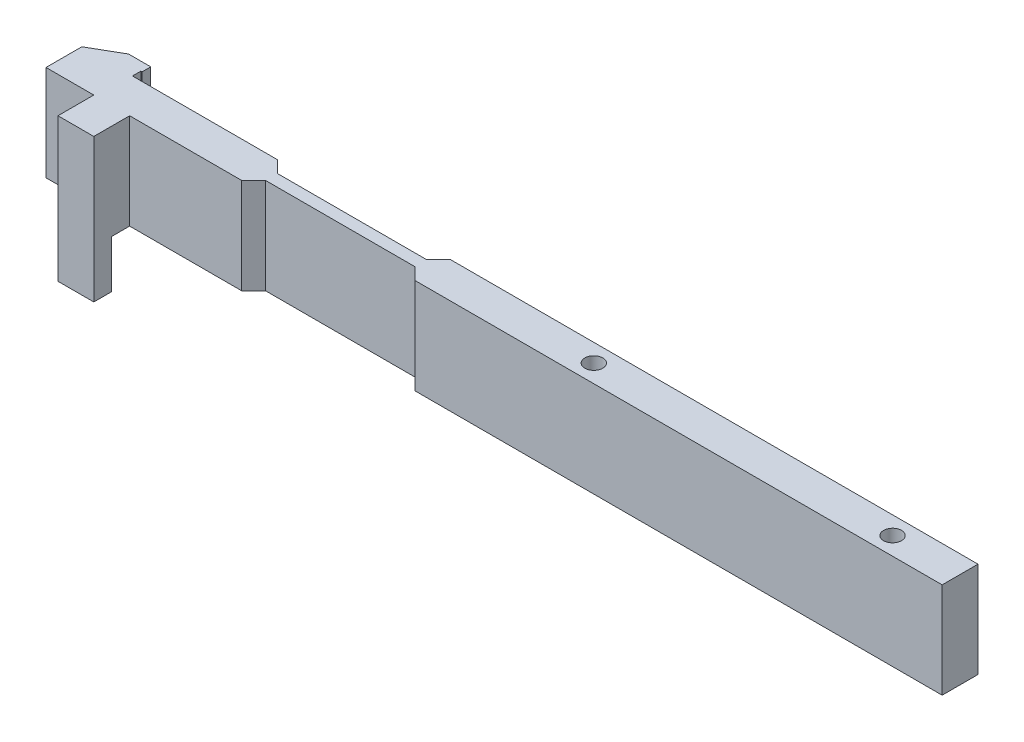
from build123d import *

# Parameters (mm, degrees)
EXTRUDE_1_DEPTH     = 16
SKETCH_3_R          = 1.5
CUT_EXTRUDE_1_DEPTH = 82.804645345
SKETCH_4_W          = 6
SKETCH_4_H          = 6
EXTRUDE_2_DEPTH     = 16
EXTRUDE_START       = -16
EXTRUDE_4_DEPTH     = 8


with BuildPart() as part:
    # Эскиз1 → Бобышка-Вытянуть1 (new body)
    with BuildSketch(Plane(origin=(0, 0, 0), x_dir=(1, 0, 0), z_dir=(0, 1, 0))):
        Polygon((0, 0), (-71.525936721, 0), (-71.525936721, 1.396480231), (-71.325936721, 1.396480231), (-71.325936721, 2.8586364), (-75.035652424, 2.8586364), (-80, -0.007531009), (-80, -6), (70, -6), (70, 0), align=None)
    extrude(amount=EXTRUDE_1_DEPTH)

    # Эскиз3 → Вырез-Вытянуть1 (cut, through all)
    with BuildSketch(Plane(origin=(0, 16, 0), x_dir=(1, 0, 0), z_dir=(0, 1, 0))):
        with Locations(Location((8.699103215, -3.003765504, 0), (0, 0, 270))):
            Circle(SKETCH_3_R)
        with Locations(Location((58.699103215, -3.003765504, 0), (0, 0, 270))):
            Circle(SKETCH_3_R)
        Polygon((-47.243192472, 0), (-45.239426968, -2.003765504), (-20.270391363, -2.003765504), (-18.266625858, 0), align=None)
        Polygon((-47.243192472, -6.007531009), (-18.266625858, -6.007531009), (-20.270391363, -4.003765504), (-45.239426968, -4.003765504), align=None)
    extrude(amount=-CUT_EXTRUDE_1_DEPTH, mode=Mode.SUBTRACT)

    # Эскиз4 → Бобышка-Вытянуть2 (add)
    with BuildSketch(Plane.XZ):
        with Locations((-69, 9)):
            Rectangle(SKETCH_4_W, SKETCH_4_H)
    extrude(amount=-EXTRUDE_2_DEPTH)

    # Эскиз5<2> → Бобышка-Вытянуть4 (add)
    with BuildSketch(Plane(origin=(0, 16, 0), x_dir=(1, 0, 0), z_dir=(0, 1, 0)).offset(EXTRUDE_START)):
        Polygon((-72, -12), (-72, -6), (-69, -6), (-66, -9), (-66, -12), align=None)
    extrude(amount=-EXTRUDE_4_DEPTH)


solid = part.part
